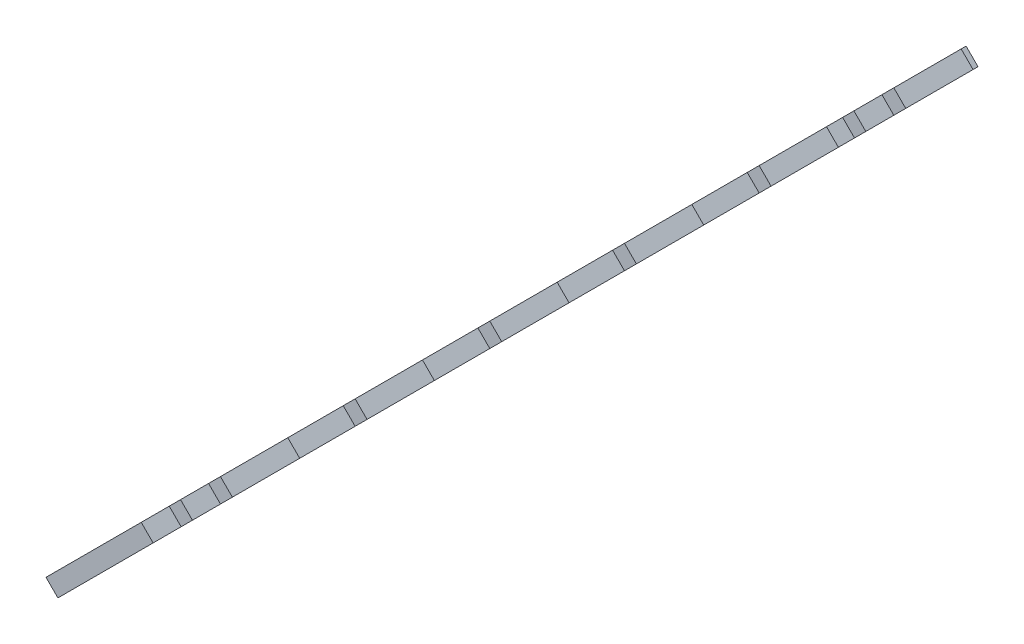
from build123d import *

# Parameters (mm, degrees)
BOSS_EXTRUDE1_DEPTH = 304.8
SKETCH2_W           = 25.4
SKETCH2_H           = 6.35
BOSS_EXTRUDE2_DEPTH = 6.35
LPATTERN1_COUNT     = 6
LPATTERN1_PITCH     = 50.8
SKETCH3_R           = 1.25
CUT_EXTRUDE1_DEPTH  = 6.35
BOSS_EXTRUDE3_DEPTH = 6.35
LPATTERN2_COUNT     = 2
LPATTERN2_PITCH     = 38.1
CUT_EXTRUDE2_DEPTH  = 319.521766414
CUT_EXTRUDE3_DEPTH  = 319.521766414
SKETCH7_R           = 2.0955
CUT_EXTRUDE4_DEPTH  = 319.521766414
SKETCH8_W           = 31.75
SKETCH8_H           = 63.5
CUT_EXTRUDE5_DEPTH  = 319.521766414
FILLET1_R           = 3.81


with BuildPart() as part:
    # Sketch1 → Boss-Extrude1 (new body)
    with BuildSketch(Plane.XY):
        Polygon((37.717075708, 7.683880312), (33.226947648, 12.174008373), (69.147972132, 48.095032857), (73.638100193, 43.604904797), align=None)
    extrude(amount=BOSS_EXTRUDE1_DEPTH)

    # Sketch2 → Boss-Extrude2 (add)
    with BuildSketch(Plane(origin=(58.621502495, 58.621502495, 0), x_dir=(0, 0, -1), z_dir=(0.7071067811865471, 0.7071067811865479, 0))):
        with Locations((-266.7, -18.061676125)):
            Rectangle(SKETCH2_W, SKETCH2_H)
    boss_extrude2 = extrude(amount=BOSS_EXTRUDE2_DEPTH)

    # LPattern1: Boss-Extrude2 ×6
    with Locations(*[(0, 0, -i * LPATTERN1_PITCH) for i in range(1, LPATTERN1_COUNT)]):
        add(boss_extrude2)

    # Sketch3 → Cut-Extrude1 (cut)
    with BuildSketch(Plane(origin=(15.016597698, -15.016597698, 0), x_dir=(0, 0, -1), z_dir=(0.7071067811865396, -0.7071067811865555, 0))):
        with Locations(Location((-273.3375, 57.503323875, 0), (0, 0, 90))):
            Circle(SKETCH3_R)
    extrude(amount=-CUT_EXTRUDE1_DEPTH, mode=Mode.SUBTRACT)

    # Sketch4 → Boss-Extrude3 (add)
    with BuildSketch(Plane(origin=(0, 0, 0), x_dir=(-1, 0, 0), z_dir=(0, 0, -1))):
        Polygon((-33.226947648, 12.174008373), (-37.717075708, 7.683880312), (-46.69733183, 16.664136433), (-42.207203769, 21.154264494), align=None)
    boss_extrude3 = extrude(amount=BOSS_EXTRUDE3_DEPTH)

    # LPattern2: Boss-Extrude3 ×2
    with Locations(*[Vector(0.7071067811865472, 0.7071067811865478, 0) * (i * LPATTERN2_PITCH) for i in range(1, LPATTERN2_COUNT)]):
        add(boss_extrude3)

    # Sketch5 → Cut-Extrude2 (cut, through all)
    with BuildSketch(Plane(origin=(10.526469638, -10.526469638, 0), x_dir=(0.7071067811865537, 0.7071067811865415, 0), z_dir=(-0.7071067811865415, 0.7071067811865537, 0))):
        Polygon((59.636923875, 0), (55.369723875, 0), (55.369723875, -8.763), (53.058323875, -8.763), (53.058323875, -11.938), (55.369723875, -11.938), (55.369723875, -15.24), (59.636923875, -15.24), (59.636923875, -11.938), (61.948323875, -11.938), (61.948323875, -8.763), (59.636923875, -8.763), align=None)
    extrude(amount=-CUT_EXTRUDE2_DEPTH, mode=Mode.SUBTRACT)

    # Sketch6 → Cut-Extrude3 (cut, through all)
    with BuildSketch(Plane(origin=(10.526469638, -10.526469638, 0), x_dir=(0.7071067811865537, 0.7071067811865415, 0), z_dir=(-0.7071067811865415, 0.7071067811865537, 0))):
        Polygon((82.903323875, -294.2336), (82.903323875, -289.9664), (74.140323875, -289.9664), (74.140323875, -287.655), (70.965323875, -287.655), (70.965323875, -289.9664), (67.663323875, -289.9664), (67.663323875, -294.2336), (70.965323875, -294.2336), (70.965323875, -296.545), (74.140323875, -296.545), (74.140323875, -294.2336), align=None)
        Polygon((82.903323875, -40.2336), (82.903323875, -35.9664), (74.140323875, -35.9664), (74.140323875, -33.655), (70.965323875, -33.655), (70.965323875, -35.9664), (67.663323875, -35.9664), (67.663323875, -40.2336), (70.965323875, -40.2336), (70.965323875, -42.545), (74.140323875, -42.545), (74.140323875, -40.2336), align=None)
    extrude(amount=-CUT_EXTRUDE3_DEPTH, mode=Mode.SUBTRACT)

    # Sketch7 → Cut-Extrude4 (cut, through all)
    with BuildSketch(Plane(origin=(15.016597698, -15.016597698, 0), x_dir=(-0.7071067811865553, -0.7071067811865398, 0), z_dir=(0.7071067811865398, -0.7071067811865553, 0))):
        with Locations(Location((-86.078323875, -215.828690193, 0), (0, 0, 180))):
            Circle(SKETCH7_R)
        with Locations(Location((-86.078323875, -63.428690193, 0), (0, 0, 180))):
            Circle(SKETCH7_R)
    extrude(amount=-CUT_EXTRUDE4_DEPTH, mode=Mode.SUBTRACT)

    # Sketch8 → Cut-Extrude5 (cut, through all)
    with BuildSketch(Plane(origin=(10.526469638, -10.526469638, 0), x_dir=(0.7071067811865537, 0.7071067811865415, 0), z_dir=(-0.7071067811865415, 0.7071067811865537, 0))):
        with Locations((47.978323875, -165.1)):
            Rectangle(SKETCH8_W, SKETCH8_H)
    extrude(amount=-CUT_EXTRUDE5_DEPTH, mode=Mode.SUBTRACT)

    # Fillet1
    fillet1_edges = [part.edges().sort_by_distance(p)[0] for p in [
        (35.472011678, 9.928944343, 196.85),
        (35.472011678, 9.928944343, 133.35),
        (57.922651981, 32.379584645, 133.35),
        (57.922651981, 32.379584645, 196.85),
    ]]
    fillet(fillet1_edges, radius=FILLET1_R)


solid = part.part
